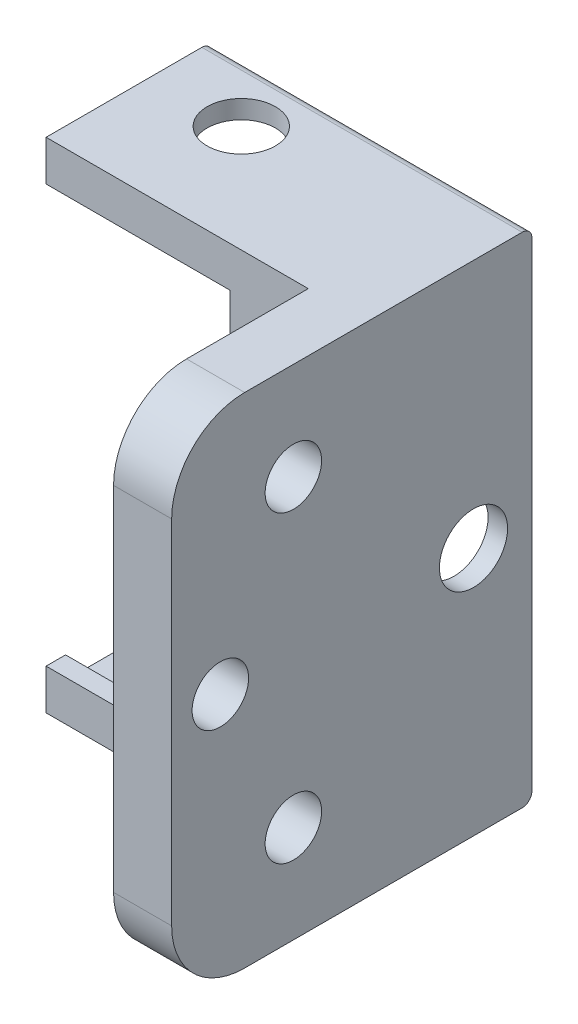
from build123d import *

# Parameters (mm, degrees)
SKETCH2_W            = 43.7
SKETCH2_H            = 47.2
SKETCH2_W_2          = 39.7
SKETCH2_H_2          = 42.879633868
SKETCH2_W_3          = 10
BOSS_EXTRUDE1_DEPTH  = 2
SKETCH3_W            = 47.7
SKETCH3_H            = 51.2
SKETCH3_W_2          = 43.7
SKETCH3_H_2          = 47.2
BOSS_EXTRUDE2_DEPTH  = 17
M6_CLEARANCE_HOLE1_D = 7
M6_CLEARANCE_HOLE2_D = 7
SKETCH9_W            = 5.969043329
SKETCH9_H            = 51.2
BOSS_EXTRUDE3_DEPTH  = 20
M5_CLEARANCE_HOLE1_D = 5.8
FILLET1_R            = 7.5
FILLET2_R            = 1
SKETCH15_W           = 14.80289281
SKETCH15_H           = 51.2
CUT_EXTRUDE1_DEPTH   = 41.301147626
SKETCH19_W           = 35.398634532
SKETCH19_H           = 47.4
CUT_EXTRUDE2_DEPTH   = 15


with BuildPart() as part:
    # Sketch2 → Boss-Extrude1 (new body)
    # profile 1 of 2: a face of its own
    with BuildSketch(Plane.XY):
        Rectangle(SKETCH2_W, SKETCH2_H)
        Rectangle(SKETCH2_W_2, SKETCH2_H_2, mode=Mode.SUBTRACT)
    # profile 2 of 2: a face of its own
    with BuildSketch(Plane.XY):
        with Locations((14.85, 0)):
            Rectangle(SKETCH2_W_3, SKETCH2_H_2)
    extrude(amount=BOSS_EXTRUDE1_DEPTH)

    # Sketch3 → Boss-Extrude2 (add)
    with BuildSketch(Plane.XY.offset(2)):
        Rectangle(SKETCH3_W, SKETCH3_H)
        Rectangle(SKETCH3_W_2, SKETCH3_H_2, mode=Mode.SUBTRACT)
    extrude(amount=-BOSS_EXTRUDE2_DEPTH)

    # M6 Clearance Hole1 (through all)
    with Locations(Plane(origin=(0, -25.6, 0), x_dir=(-1, 0, 0), z_dir=(0, -1, 0))):
        with Locations((0, 9)):
            Hole(M6_CLEARANCE_HOLE1_D / 2)

    # M6 Clearance Hole2 (through all)
    with Locations(Plane(origin=(23.85, 0, 0), x_dir=(0, 0, -1), z_dir=(1, 0, 0))):
        with Locations((9, 0)):
            Hole(M6_CLEARANCE_HOLE2_D / 2)

    # Sketch9 → Boss-Extrude3 (add)
    with BuildSketch(Plane.XY.offset(2)):
        with Locations((20.865478336, 0)):
            Rectangle(SKETCH9_W, SKETCH9_H)
    extrude(amount=BOSS_EXTRUDE3_DEPTH)

    # M5 Clearance Hole1 (through all)
    with Locations(Plane(origin=(23.85, 0, 0), x_dir=(0, 0, -1), z_dir=(1, 0, 0))):
        with Locations((-9.5, -15.6), (-9.5, 15.6), (-17, 0)):
            Hole(M5_CLEARANCE_HOLE1_D / 2)

    # Fillet1
    fillet1_edges = [part.edges().sort_by_distance(p)[0] for p in [
        (20.865478335, 25.6, 22),
        (20.865478335, -25.6, 22),
    ]]
    fillet(fillet1_edges, radius=FILLET1_R)

    # Fillet2
    fillet2_edges = [part.edges().sort_by_distance(p)[0] for p in [
        (0, 25.6, -15),
        (0, -25.6, -15),
    ]]
    fillet(fillet2_edges, radius=FILLET2_R)

    # Sketch15 → Cut-Extrude1 (cut, through all)
    with BuildSketch(Plane.XY.offset(2)):
        with Locations((-16.448553595, 0)):
            Rectangle(SKETCH15_W, SKETCH15_H)
    extrude(amount=-CUT_EXTRUDE1_DEPTH, mode=Mode.SUBTRACT)

    # Sketch19 → Cut-Extrude2 (cut)
    with BuildSketch(Plane(origin=(0, 0, -15), x_dir=(-1, 0, 0), z_dir=(0, 0, -1))):
        with Locations((-4.150682734, 0)):
            Rectangle(SKETCH19_W, SKETCH19_H)
    extrude(amount=-CUT_EXTRUDE2_DEPTH, mode=Mode.SUBTRACT)


solid = part.part
